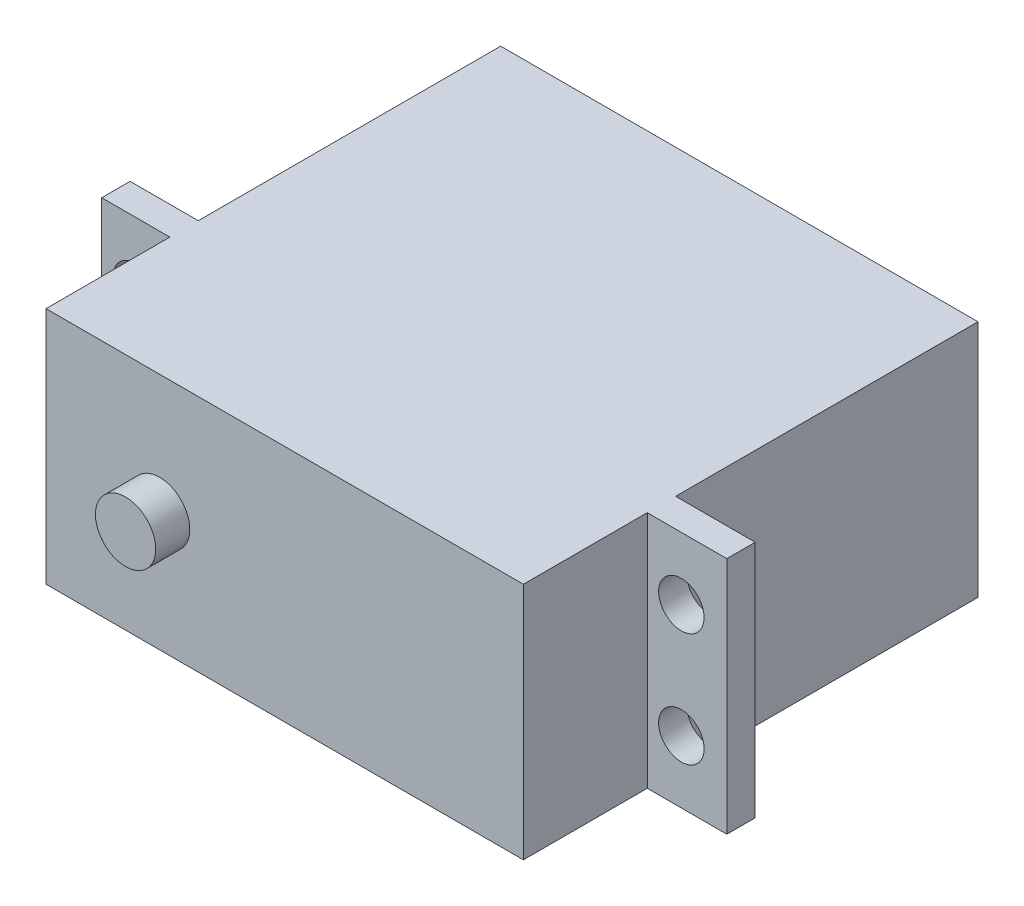
from build123d import *

# Parameters (mm, degrees)
ESQUISSE1_W             = 42
ESQUISSE1_H             = 21
BOSS_EXTRU_1_DEPTH      = 40
BOSS_EXTRU_2_DEPTH      = 7
BOSS_EXTRU_2_DEPTH_BACK = 48
ESQUISSE2_W             = 2.5
ESQUISSE2_H             = 21
ESQUISSE3_R             = 2
ENL_V_MAT_EXTRU_1_DEPTH = 7.5
ESQUISSE5_R             = 2.65
BOSS_EXTRU_3_DEPTH      = 3


with BuildPart() as part:
    # Esquisse1 → Boss.-Extru.1 (new body)
    with BuildSketch(Plane.XY):
        with Locations((11, 0)):
            Rectangle(ESQUISSE1_W, ESQUISSE1_H)
    extrude(amount=-BOSS_EXTRU_1_DEPTH)

    # Esquisse2 → Boss.-Extru.2 (add, two sides: drawn at the far end of the back side and taken through both)
    with BuildSketch(Plane(origin=(32, 0, 0), x_dir=(0, 0, -1), z_dir=(1, 0, 0)).offset(-BOSS_EXTRU_2_DEPTH_BACK)):
        with Locations((12.15, 0)):
            Rectangle(ESQUISSE2_W, ESQUISSE2_H)
    extrude(amount=BOSS_EXTRU_2_DEPTH + BOSS_EXTRU_2_DEPTH_BACK)

    # Esquisse3 → Enlèv. mat.-Extru.1 (cut)
    with BuildSketch(Plane(origin=(0, 0, -13.4), x_dir=(-1, 0, 0), z_dir=(0, 0, -1))):
        with Locations(Location((13, 5, 0), (0, 0, 270))):
            Circle(ESQUISSE3_R)
        with Locations((13, -5)):
            Circle(ESQUISSE3_R)
        with Locations(Location((-35, -5, 0), (0, 0, 270))):
            Circle(ESQUISSE3_R)
        with Locations((-35, 5)):
            Circle(ESQUISSE3_R)
    extrude(amount=-ENL_V_MAT_EXTRU_1_DEPTH, mode=Mode.SUBTRACT)

    # Esquisse5 → Boss.-Extru.3 (add)
    with BuildSketch(Plane(origin=(0, 0, 0), x_dir=(-1, 0, 0), z_dir=(0, 0, -1))):
        Circle(ESQUISSE5_R)
    extrude(amount=-BOSS_EXTRU_3_DEPTH)


solid = part.part
